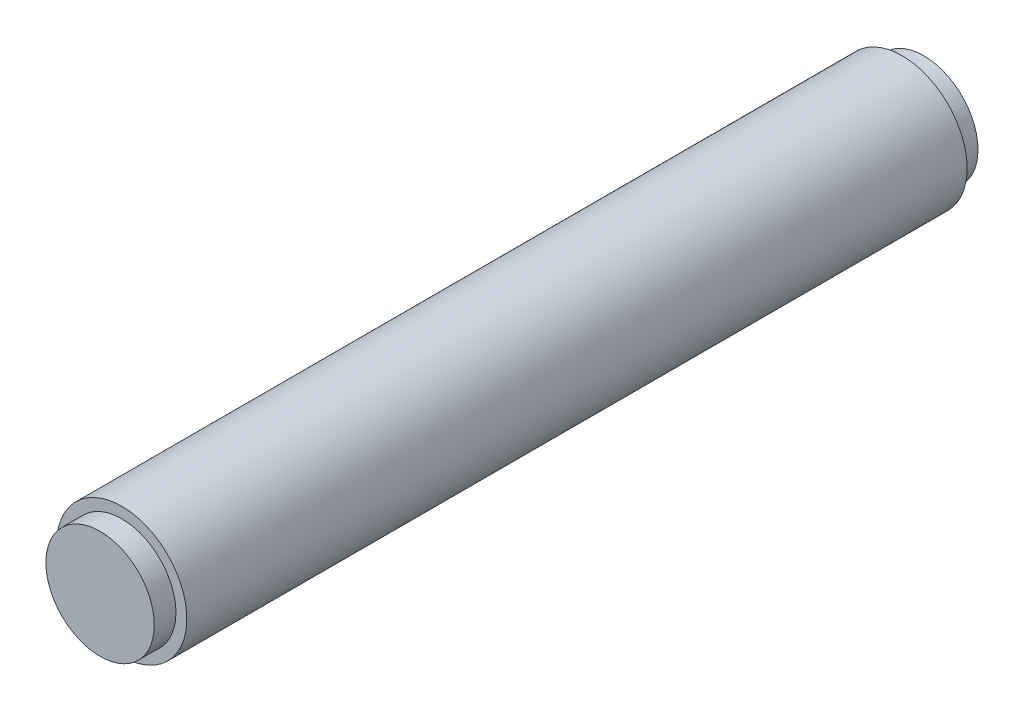
from build123d import *

# Parameters (mm, degrees)
CROQUIS1_R              = 30
SALIENTE_EXTRUIR1_DEPTH = 360
CROQUIS2_R              = 25
SALIENTE_EXTRUIR2_DEPTH = 10
SALIENTE_EXTRUIR3_START = 10
CROQUIS3_R              = 25
SALIENTE_EXTRUIR3_DEPTH = 10


with BuildPart() as part:
    # Croquis1 → Saliente-Extruir1 (new body)
    with BuildSketch(Plane.XY):
        with Locations(Location((-60.809162775, 26.76749243, 0), (0, 0, 180))):
            Circle(CROQUIS1_R)
    extrude(amount=SALIENTE_EXTRUIR1_DEPTH)

    # Croquis2 → Saliente-Extruir2 (add)
    with BuildSketch(Plane.XY.offset(360)):
        with Locations((-60.809162775, 26.76749243)):
            Circle(CROQUIS2_R)
    extrude(amount=SALIENTE_EXTRUIR2_DEPTH)

    # Croquis3 → Saliente-Extruir3 (add)
    with BuildSketch(Plane(origin=(0, 0, 0), x_dir=(-1, 0, 0), z_dir=(0, 0, -1)).offset(SALIENTE_EXTRUIR3_START)):
        with Locations(Location((60.809162775, 26.76749243, 0), (0, 0, 180))):
            Circle(CROQUIS3_R)
    extrude(amount=-SALIENTE_EXTRUIR3_DEPTH)


solid = part.part
